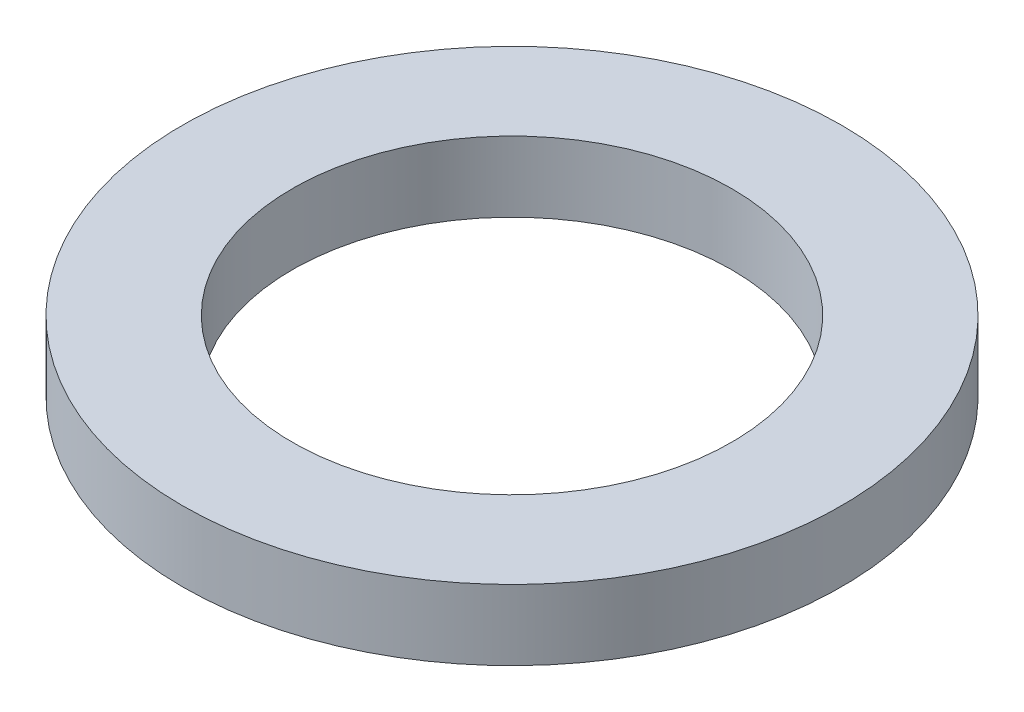
from build123d import *

# Parameters (mm, degrees)
SKETCH1_R           = 1.5
SKETCH1_R_2         = 1
BOSS_EXTRUDE1_DEPTH = 0.32


with BuildPart() as part:
    # Sketch1 → Boss-Extrude1 (new body)
    with BuildSketch(Plane(origin=(0, 0, 0), x_dir=(1, 0, 0), z_dir=(0, 1, 0))):
        with Locations(Location((0, 0, 0), (0, 0, 90))):
            Circle(SKETCH1_R)
        with Locations(Location((0, 0, 0), (0, 0, 90))):
            Circle(SKETCH1_R_2, mode=Mode.SUBTRACT)
    extrude(amount=BOSS_EXTRUDE1_DEPTH)


solid = part.part
